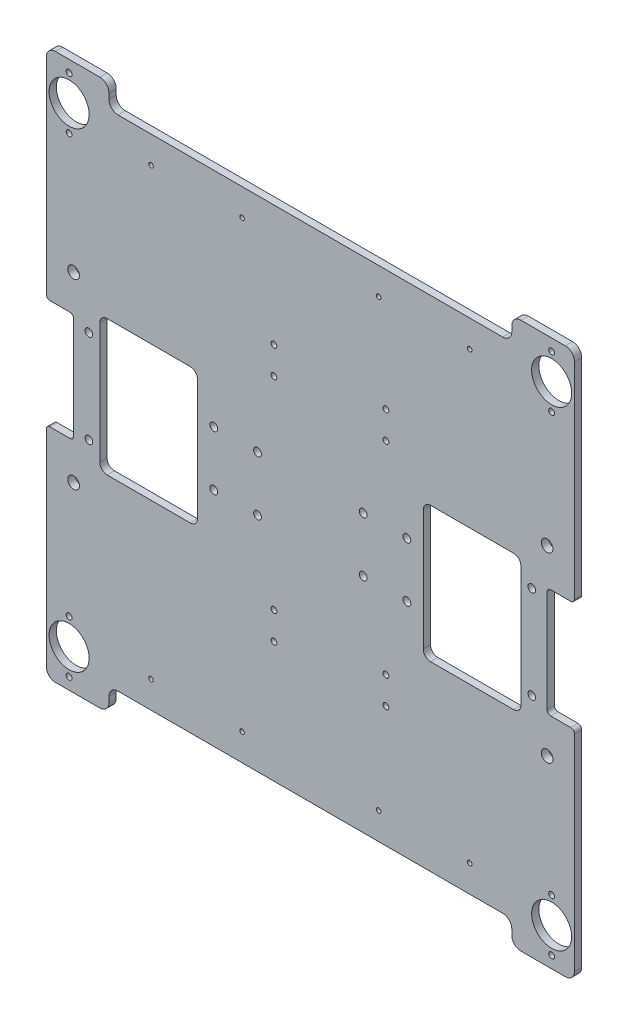
from build123d import *

# Parameters (mm, degrees)
SKETCH2_R                = 1.5
SKETCH2_R_2              = 11
SKETCH2_R_3              = 1.65
SKETCH2_R_4              = 1
BOSS_EXTRUDE1_DEPTH      = 4
M4_CLEARANCE_HOLE1_D     = 4.3
M4_CLEARANCE_HOLE1_DEPTH = 6
M4_CLEARANCE_HOLE1_TIP   = 1.291850331
M3_CLEARANCE_HOLE2_D     = 3.2
M3_CLEARANCE_HOLE2_DEPTH = 6
M3_CLEARANCE_HOLE2_TIP   = 0.96137699
M5_TAPPED_HOLE1_D        = 4.2
M5_TAPPED_HOLE1_DEPTH    = 12.4
M5_TAPPED_HOLE1_TIP      = 1.2618073
M6_CLEARANCE_HOLE1_D     = 6.4
M6_CLEARANCE_HOLE1_DEPTH = 15
M6_CLEARANCE_HOLE1_TIP   = 1.922753981
M3_TAPPED_HOLE2_D        = 2.5
M3_TAPPED_HOLE2_DEPTH    = 7.5
M3_TAPPED_HOLE2_TIP      = 0.751075774


with BuildPart() as part:
    # Sketch2 → Boss-Extrude1 (new body)
    with BuildSketch(Plane.XY):
        with BuildLine():
            Line((-140, 175), (-115.60032364, 175))
            ThreePointArc((-115.60032364, 175), (-112.064789734, 173.535533906), (-110.60032364, 170))
            Line((-110.60032364, 170), (-110.60032364, 167))
            ThreePointArc((-110.60032364, 167), (-109.135857546, 163.464466094), (-105.60032364, 162))
            Line((-105.60032364, 162), (105.60032364, 162))
            ThreePointArc((105.60032364, 162), (109.135857546, 163.464466094), (110.60032364, 167))
            Line((110.60032364, 167), (110.60032364, 170))
            ThreePointArc((110.60032364, 170), (112.064789734, 173.535533906), (115.60032364, 175))
            Line((115.60032364, 175), (140, 175))
            ThreePointArc((140, 175), (143.535533906, 173.535533906), (145, 170))
            Line((145, 170), (145, 57))
            ThreePointArc((145, 57), (144.414213562, 55.585786438), (143, 55))
            Line((143, 55), (132, 55))
            ThreePointArc((132, 55), (130.585786438, 54.414213562), (130, 53))
            Line((130, 53), (130, -3))
            ThreePointArc((130, -3), (130.585786438, -4.414213562), (132, -5))
            Line((132, -5), (143, -5))
            ThreePointArc((143, -5), (144.414213562, -5.585786438), (145, -7))
            Line((145, -7), (145, -120))
            ThreePointArc((145, -120), (143.535533906, -123.535533906), (140, -125))
            Line((140, -125), (115.60032364, -125))
            ThreePointArc((115.60032364, -125), (112.064789734, -123.535533906), (110.60032364, -120))
            Line((110.60032364, -120), (110.60032364, -117))
            ThreePointArc((110.60032364, -117), (109.135857546, -113.464466094), (105.60032364, -112))
            Line((105.60032364, -112), (-105.60032364, -112))
            ThreePointArc((-105.60032364, -112), (-109.135857546, -113.464466094), (-110.60032364, -117))
            Line((-110.60032364, -117), (-110.60032364, -120))
            ThreePointArc((-110.60032364, -120), (-112.064789734, -123.535533906), (-115.60032364, -125))
            Line((-115.60032364, -125), (-140, -125))
            ThreePointArc((-140, -125), (-143.535533906, -123.535533906), (-145, -120))
            Line((-145, -120), (-145, -7))
            ThreePointArc((-145, -7), (-144.414213562, -5.585786438), (-143, -5))
            Line((-143, -5), (-132, -5))
            ThreePointArc((-132, -5), (-130.585786438, -4.414213562), (-130, -3))
            Line((-130, -3), (-130, 53))
            ThreePointArc((-130, 53), (-130.585786438, 54.414213562), (-132, 55))
            Line((-132, 55), (-143, 55))
            ThreePointArc((-143, 55), (-144.414213562, 55.585786438), (-145, 57))
            Line((-145, 57), (-145, 170))
            ThreePointArc((-145, 170), (-143.535533906, 173.535533906), (-140, 175))
        make_face()
        with Locations((-132.473303105, 168.56037538)):
            Circle(SKETCH2_R, mode=Mode.SUBTRACT)
        with Locations((-132.473303105, 139.890769728)):
            Circle(SKETCH2_R, mode=Mode.SUBTRACT)
        with Locations((132.473303105, 168.56037538)):
            Circle(SKETCH2_R, mode=Mode.SUBTRACT)
        with Locations((132.473303105, 139.890769728)):
            Circle(SKETCH2_R, mode=Mode.SUBTRACT)
        with Locations((132.473303105, 154.225572554)):
            Circle(SKETCH2_R_2, mode=Mode.SUBTRACT)
        with Locations((-132.473303105, 154.225572554)):
            Circle(SKETCH2_R_2, mode=Mode.SUBTRACT)
        with Locations((121.59774802, -0.5)):
            Circle(SKETCH2_R_3, mode=Mode.SUBTRACT)
        with Locations((121.59774802, 50.5)):
            Circle(SKETCH2_R_3, mode=Mode.SUBTRACT)
        with Locations((-121.59774802, -0.5)):
            Circle(SKETCH2_R_3, mode=Mode.SUBTRACT)
        with Locations((-121.59774802, 50.5)):
            Circle(SKETCH2_R_3, mode=Mode.SUBTRACT)
        with Locations((-29, 10)):
            Circle(SKETCH2_R, mode=Mode.SUBTRACT)
        with Locations((-29, 40)):
            Circle(SKETCH2_R, mode=Mode.SUBTRACT)
        with Locations((-53, 40)):
            Circle(SKETCH2_R, mode=Mode.SUBTRACT)
        with Locations((-53, 10)):
            Circle(SKETCH2_R, mode=Mode.SUBTRACT)
        with Locations((53, 10)):
            Circle(SKETCH2_R, mode=Mode.SUBTRACT)
        with Locations((29, 10)):
            Circle(SKETCH2_R, mode=Mode.SUBTRACT)
        with Locations((29, 40)):
            Circle(SKETCH2_R, mode=Mode.SUBTRACT)
        with Locations((53, 40)):
            Circle(SKETCH2_R, mode=Mode.SUBTRACT)
        with Locations((132.473303105, -118.56037538)):
            Circle(SKETCH2_R, mode=Mode.SUBTRACT)
        with Locations((132.473303105, -89.890769728)):
            Circle(SKETCH2_R, mode=Mode.SUBTRACT)
        with Locations((132.473303105, -104.225572554)):
            Circle(SKETCH2_R_2, mode=Mode.SUBTRACT)
        with Locations((-132.473303105, -104.225572554)):
            Circle(SKETCH2_R_2, mode=Mode.SUBTRACT)
        with Locations((-132.473303105, -89.890769728)):
            Circle(SKETCH2_R, mode=Mode.SUBTRACT)
        with Locations((-132.473303105, -118.56037538)):
            Circle(SKETCH2_R, mode=Mode.SUBTRACT)
        with Locations((130, 75)):
            Circle(SKETCH2_R, mode=Mode.SUBTRACT)
        with Locations((41.5, 95.575)):
            Circle(SKETCH2_R_4, mode=Mode.SUBTRACT)
        with Locations((41.5, 80.575)):
            Circle(SKETCH2_R_4, mode=Mode.SUBTRACT)
        with Locations((-20, 80.575)):
            Circle(SKETCH2_R_4, mode=Mode.SUBTRACT)
        with Locations((-20, 95.575)):
            Circle(SKETCH2_R_4, mode=Mode.SUBTRACT)
        with Locations((-20, -45.575)):
            Circle(SKETCH2_R_4, mode=Mode.SUBTRACT)
        with Locations((-20, -30.575)):
            Circle(SKETCH2_R_4, mode=Mode.SUBTRACT)
        with Locations((41.5, -30.575)):
            Circle(SKETCH2_R_4, mode=Mode.SUBTRACT)
        with Locations((41.5, -45.575)):
            Circle(SKETCH2_R_4, mode=Mode.SUBTRACT)
        with Locations((130, -25)):
            Circle(SKETCH2_R, mode=Mode.SUBTRACT)
        with Locations((-130, 75)):
            Circle(SKETCH2_R, mode=Mode.SUBTRACT)
        with Locations((-130, -25)):
            Circle(SKETCH2_R, mode=Mode.SUBTRACT)
        with Locations((87.5, 147.175)):
            Circle(SKETCH2_R_4, mode=Mode.SUBTRACT)
        with Locations((37.5, 147.175)):
            Circle(SKETCH2_R_4, mode=Mode.SUBTRACT)
        with Locations((-37.5, 147.175)):
            Circle(SKETCH2_R_4, mode=Mode.SUBTRACT)
        with Locations((-87.5, 147.175)):
            Circle(SKETCH2_R_4, mode=Mode.SUBTRACT)
        with Locations((-87.5, -97.175)):
            Circle(SKETCH2_R_4, mode=Mode.SUBTRACT)
        with Locations((-37.5, -97.175)):
            Circle(SKETCH2_R_4, mode=Mode.SUBTRACT)
        with Locations((37.5, -97.175)):
            Circle(SKETCH2_R_4, mode=Mode.SUBTRACT)
        with Locations((87.5, -97.175)):
            Circle(SKETCH2_R_4, mode=Mode.SUBTRACT)
        with BuildLine():
            Line((-66, 62.171403079), (-111.59774802, 62.171403079))
            ThreePointArc((-111.59774802, 62.171403079), (-114.426175145, 60.999830204), (-115.59774802, 58.171403079))
            Line((-115.59774802, 58.171403079), (-115.59774802, -8.171403079))
            ThreePointArc((-115.59774802, -8.171403079), (-114.426175145, -10.999830204), (-111.59774802, -12.171403079))
            Line((-111.59774802, -12.171403079), (-66, -12.171403079))
            ThreePointArc((-66, -12.171403079), (-63.171572875, -10.999830204), (-62, -8.171403079))
            Line((-62, -8.171403079), (-62, 58.171403079))
            ThreePointArc((-62, 58.171403079), (-63.171572875, 60.999830204), (-66, 62.171403079))
        make_face(mode=Mode.SUBTRACT)
        with BuildLine():
            Line((66, 62.171403079), (111.59774802, 62.171403079))
            ThreePointArc((111.59774802, 62.171403079), (114.426175145, 60.999830204), (115.59774802, 58.171403079))
            Line((115.59774802, 58.171403079), (115.59774802, -8.171403079))
            ThreePointArc((115.59774802, -8.171403079), (114.426175145, -10.999830204), (111.59774802, -12.171403079))
            Line((111.59774802, -12.171403079), (66, -12.171403079))
            ThreePointArc((66, -12.171403079), (63.171572875, -10.999830204), (62, -8.171403079))
            Line((62, -8.171403079), (62, 58.171403079))
            ThreePointArc((62, 58.171403079), (63.171572875, 60.999830204), (66, 62.171403079))
        make_face(mode=Mode.SUBTRACT)
    extrude(amount=BOSS_EXTRUDE1_DEPTH)

    # M4 Clearance Hole1
    with Locations(Plane(origin=(-53, 40, 4), x_dir=(1, 0, 0), z_dir=(0, 0, 1))):
        with Locations((0, 0), (24, 0), (24, -30), (0, -30), (82, 0), (106, 0), (106, -30), (82, -30)):
            Hole(M4_CLEARANCE_HOLE1_D / 2, depth=M4_CLEARANCE_HOLE1_DEPTH)
            with Locations((0, 0, -(M4_CLEARANCE_HOLE1_DEPTH + M4_CLEARANCE_HOLE1_TIP / 2))):  # 118° drill point
                Cone(0, M4_CLEARANCE_HOLE1_D / 2, M4_CLEARANCE_HOLE1_TIP, mode=Mode.SUBTRACT)

    # M3 Clearance Hole2
    with Locations(Plane(origin=(-132.473303105, 168.56037538, 4), x_dir=(1, 0, 0), z_dir=(0, 0, 1))):
        with Locations((0, 0), (0, -28.669605652), (264.94660621, -28.669605652), (264.94660621, 0), (173.973303105, -87.98537538), (173.973303105, -72.98537538), (112.473303105, -72.98537538), (112.473303105, -87.98537538), (173.973303105, -199.13537538), (173.973303105, -214.13537538), (112.473303105, -214.13537538), (112.473303105, -199.13537538), (264.94660621, -258.451145108), (264.94660621, -287.12075076), (0, -287.12075076), (0, -258.451145108)):
            Hole(M3_CLEARANCE_HOLE2_D / 2, depth=M3_CLEARANCE_HOLE2_DEPTH)
            with Locations((0, 0, -(M3_CLEARANCE_HOLE2_DEPTH + M3_CLEARANCE_HOLE2_TIP / 2))):  # 118° drill point
                Cone(0, M3_CLEARANCE_HOLE2_D / 2, M3_CLEARANCE_HOLE2_TIP, mode=Mode.SUBTRACT)

    # M5 Tapped Hole1
    with Locations(Plane(origin=(-121.59774802, 50.5, 4), x_dir=(1, 0, 0), z_dir=(0, 0, 1))):
        with Locations((0, 0), (0, -51), (243.19549604, -51), (243.19549604, 0)):
            Hole(M5_TAPPED_HOLE1_D / 2, depth=M5_TAPPED_HOLE1_DEPTH)
            with Locations((0, 0, -(M5_TAPPED_HOLE1_DEPTH + M5_TAPPED_HOLE1_TIP / 2))):  # 118° drill point
                Cone(0, M5_TAPPED_HOLE1_D / 2, M5_TAPPED_HOLE1_TIP, mode=Mode.SUBTRACT)

    # M6 Clearance Hole1
    with Locations(Plane(origin=(-130, 75, 4), x_dir=(1, 0, 0), z_dir=(0, 0, 1))):
        with Locations((0, 0), (260, 0), (260, -100), (0, -100)):
            Hole(M6_CLEARANCE_HOLE1_D / 2, depth=M6_CLEARANCE_HOLE1_DEPTH)
            with Locations((0, 0, -(M6_CLEARANCE_HOLE1_DEPTH + M6_CLEARANCE_HOLE1_TIP / 2))):  # 118° drill point
                Cone(0, M6_CLEARANCE_HOLE1_D / 2, M6_CLEARANCE_HOLE1_TIP, mode=Mode.SUBTRACT)

    # M3 Tapped Hole2
    with Locations(Plane(origin=(-87.5, 147.175, 4), x_dir=(1, 0, 0), z_dir=(0, 0, 1))):
        with Locations((0, 0), (50, 0), (125, 0), (175, 0), (175, -244.35), (125, -244.35), (50, -244.35), (0, -244.35)):
            Hole(M3_TAPPED_HOLE2_D / 2, depth=M3_TAPPED_HOLE2_DEPTH)
            with Locations((0, 0, -(M3_TAPPED_HOLE2_DEPTH + M3_TAPPED_HOLE2_TIP / 2))):  # 118° drill point
                Cone(0, M3_TAPPED_HOLE2_D / 2, M3_TAPPED_HOLE2_TIP, mode=Mode.SUBTRACT)


solid = part.part
